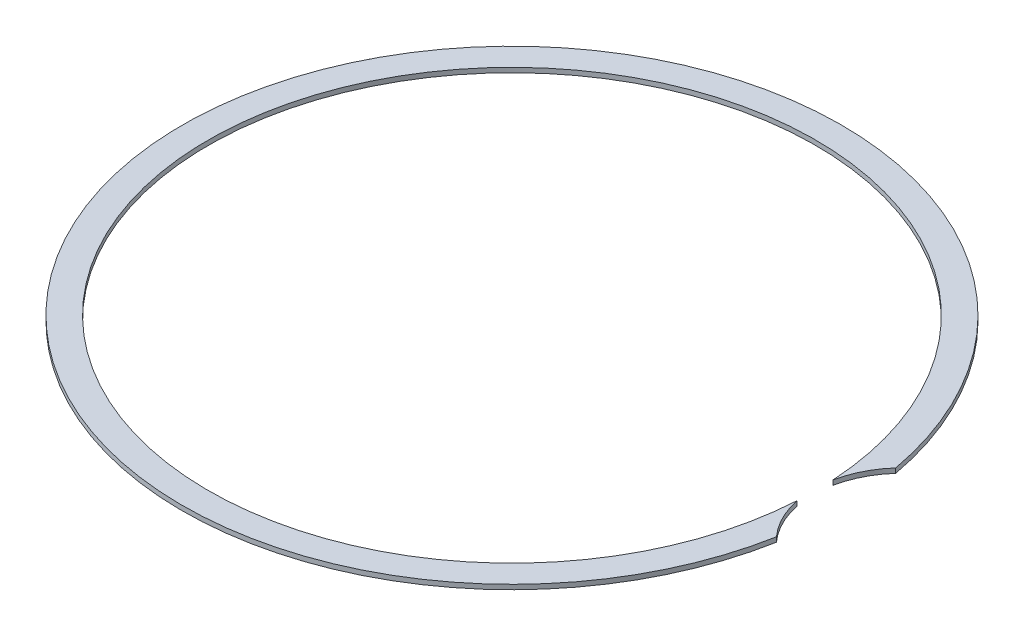
from build123d import *

# Parameters (mm, degrees)
EXTRUDE_1_DEPTH = 0.5


with BuildPart() as part:
    # 草图1 → 凸台-拉伸1 (new body)
    with BuildSketch(Plane(origin=(0, 0, 0), x_dir=(1, 0, 0), z_dir=(0, 1, 0))):
        with BuildLine():
            ThreePointArc((32.193524096, 1.907749002), (-32.25, 0), (32.193524096, -1.907749002))
            ThreePointArc((32.193524096, -1.907749002), (33.013650231, -4.269879108), (34.421686747, -6.336204029))
            ThreePointArc((34.421686747, -6.336204029), (-35, 0), (34.421686747, 6.336204029))
            ThreePointArc((34.421686747, 6.336204029), (33.013650231, 4.269879108), (32.193524096, 1.907749002))
        make_face()
    extrude(amount=EXTRUDE_1_DEPTH)


solid = part.part
